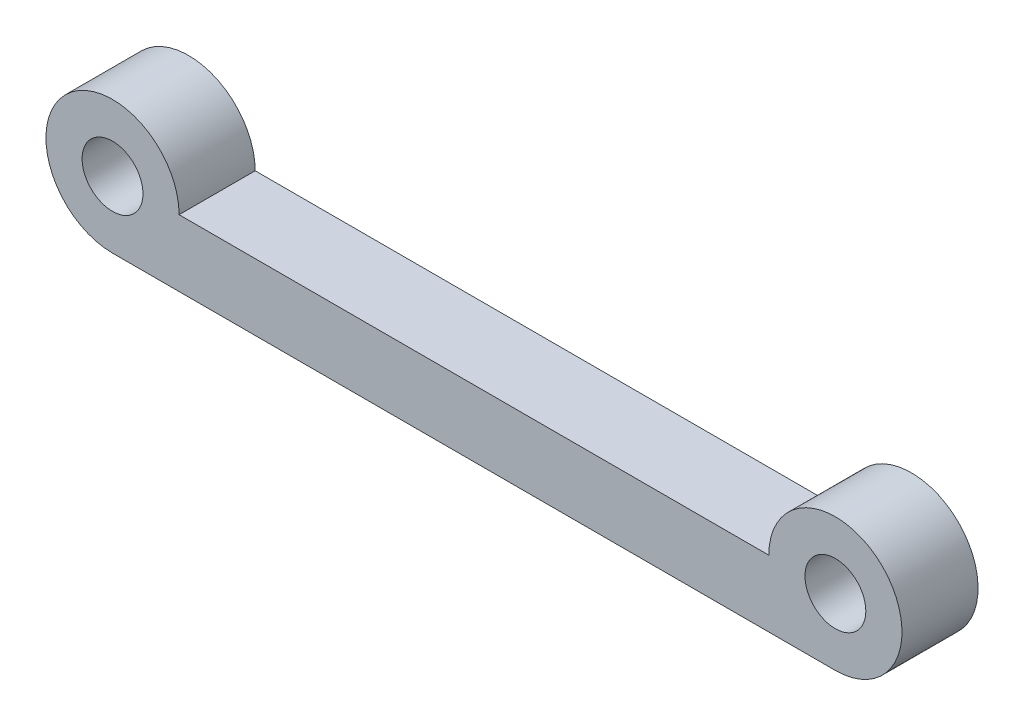
from build123d import *

# Parameters (mm, degrees)
SKETCH_1_R      = 1.6
EXTRUDE_1_DEPTH = 4


with BuildPart() as part:
    # ｽｹｯﾁ1 → ﾎﾞｽ - 押し出し1 (new body)
    with BuildSketch(Plane.XY):
        with BuildLine():
            Line((0, -3.5), (38, -3.5))
            ThreePointArc((38, -3.5), (40.474873734, 2.474873734), (34.5, 0))
            Line((34.5, 0), (3.5, 0))
            ThreePointArc((3.5, 0), (-2.474873734, 2.474873734), (0, -3.5))
        make_face()
        Circle(SKETCH_1_R, mode=Mode.SUBTRACT)
        with Locations((38, 0)):
            Circle(SKETCH_1_R, mode=Mode.SUBTRACT)
    extrude(amount=EXTRUDE_1_DEPTH)


solid = part.part
